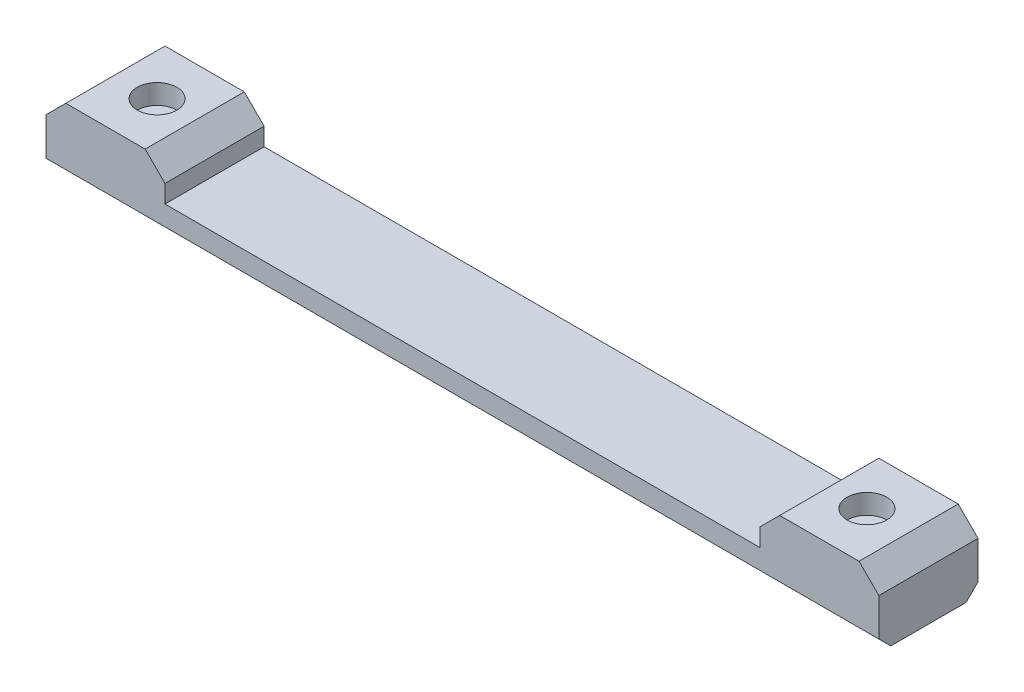
from build123d import *

# Parameters (mm, degrees)
EXTRUDE_1_DEPTH      = 9.5
EXTRUDE_1_DEPTH_BACK = 8
SKETCH_1_W           = 210
SKETCH_1_H           = 25
SKETCH_2_W           = 150
SKETCH_2_H           = 25
CUT_EXTRUDE_1_DEPTH  = 9.5
SKETCH_3_R           = 5
CUT_EXTRUDE_2_DEPTH  = 5
CHAMFER_1_SIZE       = 5
CHAMFER_2_SIZE       = 3


with BuildPart() as part:
    # 草图1 → 凸台-拉伸1 (new, two sides: drawn at the far end of the back side and taken through both)
    with BuildSketch(Plane(origin=(0, 0, 0), x_dir=(1, 0, 0), z_dir=(0, 1, 0)).offset(-EXTRUDE_1_DEPTH_BACK)):
        Rectangle(SKETCH_1_W, SKETCH_1_H)
    extrude(amount=EXTRUDE_1_DEPTH + EXTRUDE_1_DEPTH_BACK)

    # 草图2 → 切除-拉伸1 (cut)
    with BuildSketch(Plane(origin=(0, 9.5, 0), x_dir=(1, 0, 0), z_dir=(0, 1, 0))):
        Rectangle(SKETCH_2_W, SKETCH_2_H)
    extrude(amount=-CUT_EXTRUDE_1_DEPTH, mode=Mode.SUBTRACT)

    # 草图3 → 切除-拉伸2 (cut)
    with BuildSketch(Plane(origin=(0, 9.5, 0), x_dir=(1, 0, 0), z_dir=(0, 1, 0))):
        with Locations(Location((-89.5, 0, 0), (0, 0, 270))):
            Circle(SKETCH_3_R)
        with Locations(Location((89.5, 0, 0), (0, 0, 90))):
            Circle(SKETCH_3_R)
    extrude(amount=-CUT_EXTRUDE_2_DEPTH, mode=Mode.SUBTRACT)

    # 倒角1
    chamfer_1_edges = [part.edges().sort_by_distance(p)[0] for p in [
        (-105, 9.5, 0),
        (105, 9.5, 0),
        (-75, 9.5, 0),
        (75, 9.5, 0),
    ]]
    chamfer(chamfer_1_edges, length=CHAMFER_1_SIZE)

    # 倒角2
    chamfer_2_edges = [part.edges().sort_by_distance(p)[0] for p in [
        (0, -8, -12.5),
        (0, -8, 12.5),
    ]]
    chamfer(chamfer_2_edges, length=CHAMFER_2_SIZE)


solid = part.part
